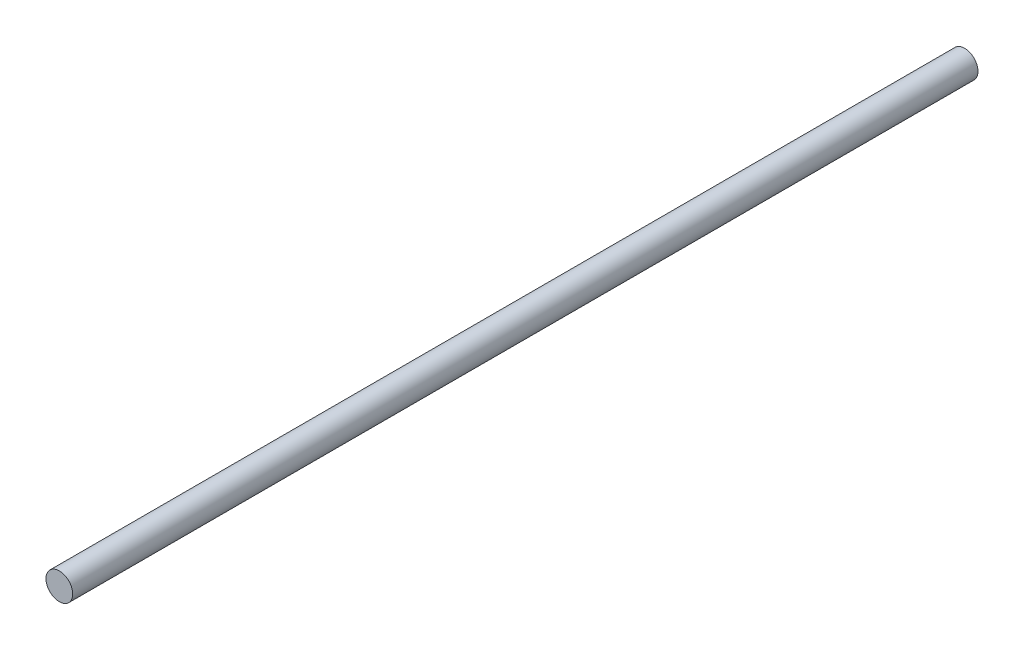
from build123d import *

# Parameters (mm, degrees)
SKETCH1_R           = 1.55
BOSS_EXTRUDE1_DEPTH = 105


with BuildPart() as part:
    # Sketch1 → Boss-Extrude1 (new body)
    with BuildSketch(Plane.XY):
        Circle(SKETCH1_R)
    extrude(amount=BOSS_EXTRUDE1_DEPTH)


solid = part.part
